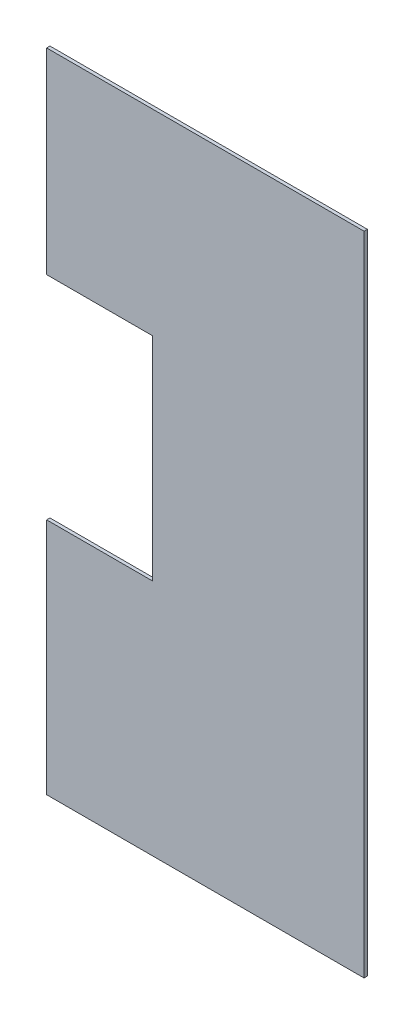
from build123d import *

# Parameters (mm, degrees)
SKETCH_1_W          = 1200
SKETCH_1_H          = 2445
EXTRUDE_1_DEPTH     = 12.5
SKETCH_3_W          = 400
SKETCH_3_H          = 802.75
CUT_EXTRUDE_2_DEPTH = 2724.63383185


with BuildPart() as part:
    # Эскиз1 → Бобышка-Вытянуть1 (new body)
    with BuildSketch(Plane.XY):
        with Locations((-600, 1222.5)):
            Rectangle(SKETCH_1_W, SKETCH_1_H)
    extrude(amount=-EXTRUDE_1_DEPTH)

    # Эскиз3 → Вырез-Вытянуть2 (cut, through all)
    with BuildSketch(Plane.XY):
        with Locations((-1000, 1301.375)):
            Rectangle(SKETCH_3_W, SKETCH_3_H)
    extrude(amount=-CUT_EXTRUDE_2_DEPTH, mode=Mode.SUBTRACT)


solid = part.part
